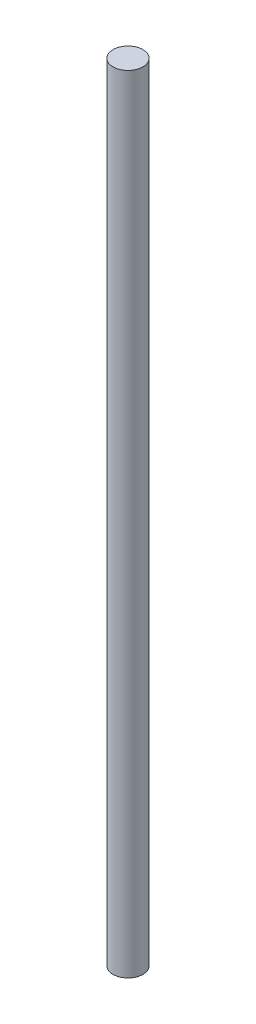
from build123d import *

# Parameters (mm, degrees)
SKETCH1_R           = 4
BOSS_EXTRUDE1_DEPTH = 105


with BuildPart() as part:
    # Sketch1 → Boss-Extrude1 (new, symmetric)
    with BuildSketch(Plane(origin=(0, 0, 0), x_dir=(1, 0, 0), z_dir=(0, 1, 0))):
        with Locations(Location((0, 0, 0), (0, 0, 270))):
            Circle(SKETCH1_R)
    extrude(amount=BOSS_EXTRUDE1_DEPTH, both=True)


solid = part.part
